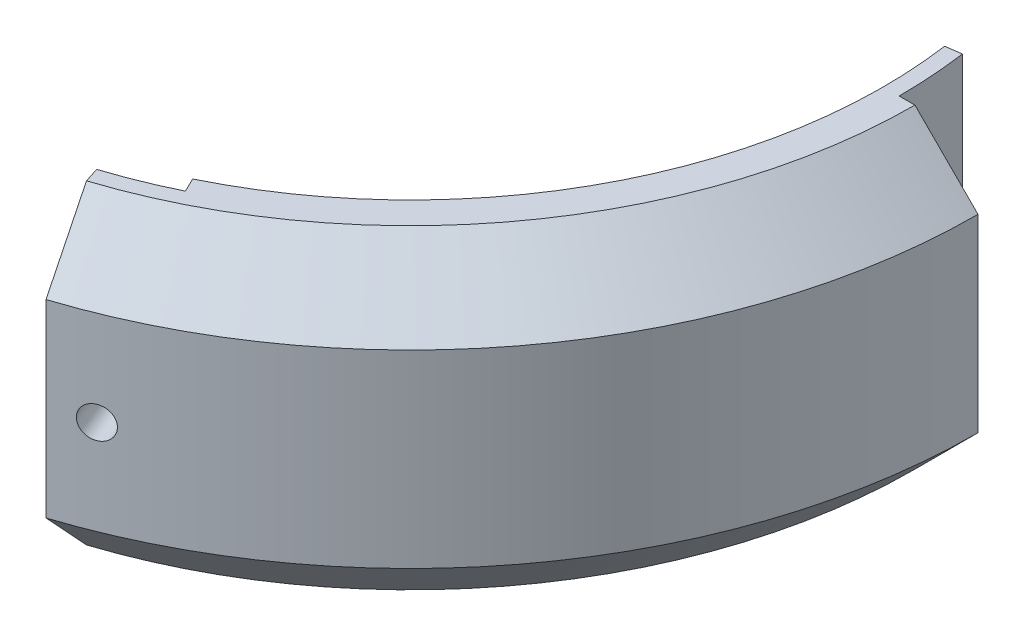
from build123d import *

# Parameters (mm, degrees)
REVOLVE1_ANGLE           = 72
REVOLVE1_OTHER_WAY_ANGLE = 8
CUT_EXTRUDE2_DEPTH       = 127.694588784
CUT_EXTRUDE2_DEPTH_BACK  = 127.694588784
SKETCH5_R                = 2.5
CUT_EXTRUDE3_DEPTH       = 127.694588784
CIRPATTERN1_COUNT        = 2
CIRPATTERN1_ANGLE        = 72


with BuildPart() as part:
    # Sketch1 → Revolve1 (revolve)
    with BuildSketch(Plane.XY):
        Polygon((75, 25), (75, 12.5), (70, 7.5), (70, -7.5), (75, -12.5), (75, -25), (80, -25), (90, -15), (90, 15), (80, 25), align=None)
    revolve(axis=Axis((0, 54.030986193, 0), (0, -1, 0)), revolution_arc=REVOLVE1_ANGLE)

    # Sketch1 → Revolve1 other way (revolve)
    with BuildSketch(Plane.XY):
        Polygon((75, 25), (75, 12.5), (70, 7.5), (70, -7.5), (75, -12.5), (75, -25), (80, -25), (90, -15), (90, 15), (80, 25), align=None)
    revolve(axis=Axis((0, 54.030986193, 0), (0, 1, 0)), revolution_arc=REVOLVE1_OTHER_WAY_ANGLE)

    # Sketch2 → Cut-Extrude2 (cut, two sides: drawn at the far end of the back side and taken through both)
    with BuildSketch(Plane(origin=(0, 0, 0), x_dir=(1, 0, 0), z_dir=(0, 1, 0)).offset(-CUT_EXTRUDE2_DEPTH_BACK)):
        with BuildLine():
            ThreePointArc((76.745775327, 10.785915324), (77.311213895, 5.406126715), (77.5, 0))
            Line((77.5, 0), (90, 0))
            ThreePointArc((90, 0), (89.780764523, 6.278082637), (89.124126187, 12.525579086))
            Line((89.124126187, 12.525579086), (76.745775327, 10.785915324))
        make_face()
        with BuildLine():
            Line((33.973763876, -69.656538588), (30.685980275, -62.915583241))
            ThreePointArc((30.685980275, -62.915583241), (26.222461539, -64.90286982), (21.631189606, -66.573956141))
            Line((21.631189606, -66.573956141), (23.176274578, -71.329238722))
            Line((23.176274578, -71.329238722), (23.948817064, -73.706880013))
            ThreePointArc((23.948817064, -73.706880013), (29.03201099, -71.856748729), (33.973763876, -69.656538588))
        make_face()
    extrude(amount=CUT_EXTRUDE2_DEPTH + CUT_EXTRUDE2_DEPTH_BACK, mode=Mode.SUBTRACT)

    # Sketch5 → Cut-Extrude3 (cut, through all)
    with BuildSketch(Plane(origin=(0, 0, 0), x_dir=(0.9271838545667883, 0, -0.3746065934159098), z_dir=(0.3746065934159098, 0, 0.9271838545667883))):
        with Locations(Location((0, 0, 0), (0, 0, 180))):
            Circle(SKETCH5_R)
    cut_extrude3 = extrude(amount=CUT_EXTRUDE3_DEPTH, mode=Mode.SUBTRACT)

    # CirPattern1: Cut-Extrude3 ×2 about axis
    cirpattern1_axis = Axis((0, 54.030986193, 0), (0, 1, 0))
    for i in range(1, CIRPATTERN1_COUNT):
        add(cut_extrude3.rotate(cirpattern1_axis, i * CIRPATTERN1_ANGLE / (CIRPATTERN1_COUNT - 1)), mode=Mode.SUBTRACT)


solid = part.part
